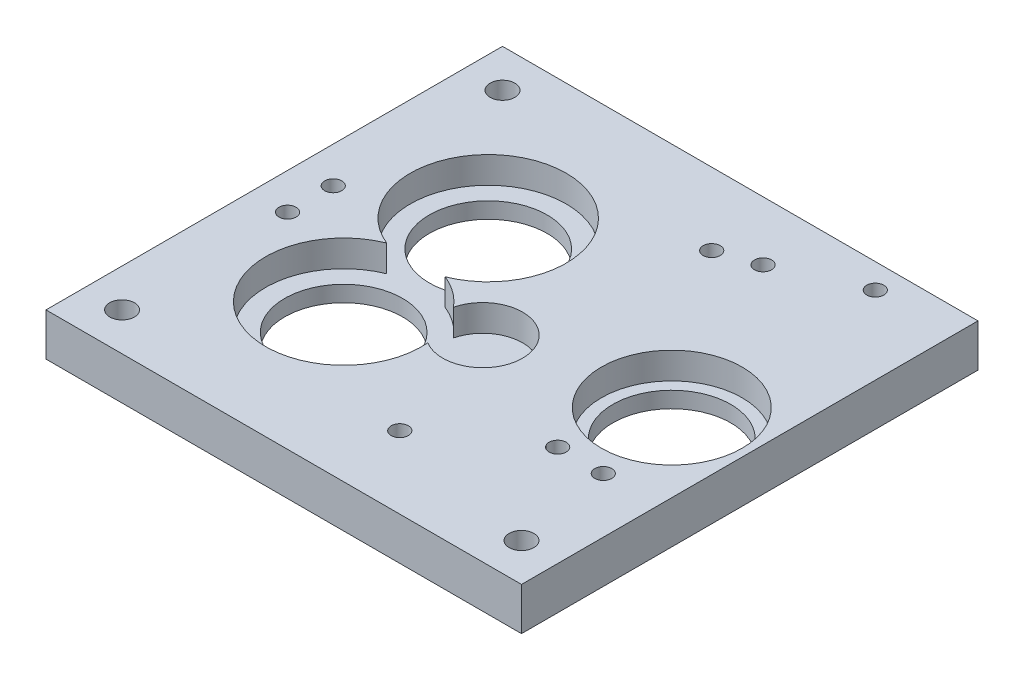
from build123d import *

# Parameters (mm, degrees)
SKETCH1_W                        = 125
SKETCH1_H                        = 120
TEST_BASE_POSTION_DEPTH          = 11.215
SKETCH8_R                        = 20.5
FINGER_GEARS_DEPTH               = 7
SKETCH9_R                        = 10.5
INTERMEDIATE_GEAR_DEPTH          = 7
SKETCH11_R                       = 18.5
XL320_FINGER_KNUCKLE_MOUNT_DEPTH = 7
SKETCH10_R                       = 15.5
CONNECT_FINGER_HOLES_DEPTH       = 88.361468766
THUMB_MOUNT_HOLES_R              = 2.25
THUMB_MOUNT_HOLES_M4_DEPTH       = 88.361468766
SKETCH16_R                       = 2.25
FINGERS_MOUNT_HOLES_M4_DEPTH     = 88.361468766
SKETCH17_R                       = 3.25
CONNECT_HOLES_M6_DEPTH           = 88.361468766
SKETCH18_R                       = 3.75
NUTS_M4_DEPTH                    = 4
SKETCH19_R                       = 5.25
NUTS_M6_DEPTH                    = 6


with BuildPart() as part:
    # Sketch1 → Test_Base_Postion (new body)
    with BuildSketch(Plane(origin=(0, 0, 0), x_dir=(1, 0, 0), z_dir=(0, 1, 0))):
        Rectangle(SKETCH1_W, SKETCH1_H)
    extrude(amount=TEST_BASE_POSTION_DEPTH)

    # Sketch8 → Finger_Gears (cut)
    with BuildSketch(Plane(origin=(0, 11.215, 0), x_dir=(1, 0, 0), z_dir=(0, 1, 0))):
        with Locations((-25.25, -19)):
            Circle(SKETCH8_R)
        with Locations((-25.25, 19)):
            Circle(SKETCH8_R)
    extrude(amount=-FINGER_GEARS_DEPTH, mode=Mode.SUBTRACT)

    # Sketch9 → Intermediate_Gear (cut)
    with BuildSketch(Plane(origin=(0, 11.215, 0), x_dir=(1, 0, 0), z_dir=(0, 1, 0))):
        with Locations((0.646123438, -8.351488795)):
            Circle(SKETCH9_R)
    extrude(amount=-INTERMEDIATE_GEAR_DEPTH, mode=Mode.SUBTRACT)

    # Sketch11 → XL320_Finger_Knuckle_Mount (cut)
    with BuildSketch(Plane(origin=(0, 11.215, 0), x_dir=(1, 0, 0), z_dir=(0, 1, 0))):
        with Locations(Location((42, 0, 0), (0, 0, 270))):
            Circle(SKETCH11_R)
    extrude(amount=-XL320_FINGER_KNUCKLE_MOUNT_DEPTH, mode=Mode.SUBTRACT)

    # Sketch10 → Connect_Finger_Holes (cut, through all)
    with BuildSketch(Plane(origin=(0, 11.215, 0), x_dir=(1, 0, 0), z_dir=(0, 1, 0))):
        with Locations(Location((-25.25, 19, 0), (0, 0, 270))):
            Circle(SKETCH10_R)
        with Locations(Location((-25.25, -19, 0), (0, 0, 270))):
            Circle(SKETCH10_R)
        with Locations(Location((42, 0, 0), (0, 0, 270))):
            Circle(SKETCH10_R)
    extrude(amount=-CONNECT_FINGER_HOLES_DEPTH, mode=Mode.SUBTRACT)

    # Thumb_Mount_Holes → Thumb_Mount_Holes_(M4) (cut, through all)
    with BuildSketch(Plane(origin=(0, 11.215, 0), x_dir=(1, 0, 0), z_dir=(0, 1, 0))):
        with Locations(Location((21.5, 44.5, 0), (0, 0, 270))):
            Circle(THUMB_MOUNT_HOLES_R)
        with Locations(Location((42, 53.5, 0), (0, 0, 270))):
            Circle(THUMB_MOUNT_HOLES_R)
        with Locations(Location((48, -24, 0), (0, 0, 270))):
            Circle(THUMB_MOUNT_HOLES_R)
        with Locations(Location((36, -24, 0), (0, 0, 270))):
            Circle(THUMB_MOUNT_HOLES_R)
    extrude(amount=-THUMB_MOUNT_HOLES_M4_DEPTH, mode=Mode.SUBTRACT)

    # Sketch16 → Fingers_Mount_Holes_(M4) (cut, through all)
    with BuildSketch(Plane(origin=(0, 11.215, 0), x_dir=(1, 0, 0), z_dir=(0, 1, 0))):
        with Locations(Location((11.5, 41, 0), (0, 0, 270))):
            Circle(SKETCH16_R)
        with Locations(Location((11.5, -41, 0), (0, 0, 270))):
            Circle(SKETCH16_R)
        with Locations(Location((-53, 6, 0), (0, 0, 270))):
            Circle(SKETCH16_R)
        with Locations(Location((-53, -6, 0), (0, 0, 270))):
            Circle(SKETCH16_R)
    extrude(amount=-FINGERS_MOUNT_HOLES_M4_DEPTH, mode=Mode.SUBTRACT)

    # Sketch17 → Connect_Holes_(M6) (cut, through all)
    with BuildSketch(Plane(origin=(0, 11.215, 0), x_dir=(1, 0, 0), z_dir=(0, 1, 0))):
        with Locations(Location((-52.5, 50, 0), (0, 0, 270))):
            Circle(SKETCH17_R)
        with Locations(Location((-52.5, -50, 0), (0, 0, 270))):
            Circle(SKETCH17_R)
        with Locations(Location((52.5, -50, 0), (0, 0, 270))):
            Circle(SKETCH17_R)
    extrude(amount=-CONNECT_HOLES_M6_DEPTH, mode=Mode.SUBTRACT)

    # Sketch18 → Nuts_(M4) (cut)
    with BuildSketch(Plane.XZ):
        with Locations(Location((11.5, 41, 0), (0, 0, 270))):
            Circle(SKETCH18_R)
        with Locations(Location((11.5, -41, 0), (0, 0, 270))):
            Circle(SKETCH18_R)
        with Locations(Location((21.5, -44.5, 0), (0, 0, 270))):
            Circle(SKETCH18_R)
        with Locations(Location((42, -53.5, 0), (0, 0, 270))):
            Circle(SKETCH18_R)
    extrude(amount=-NUTS_M4_DEPTH, mode=Mode.SUBTRACT)

    # Sketch19 → Nuts_(M6) (cut)
    with BuildSketch(Plane.XZ):
        with Locations(Location((-52.5, 50, 0), (0, 0, 270))):
            Circle(SKETCH19_R)
        with Locations(Location((52.5, 50, 0), (0, 0, 270))):
            Circle(SKETCH19_R)
        with Locations(Location((-52.5, -50, 0), (0, 0, 270))):
            Circle(SKETCH19_R)
    extrude(amount=-NUTS_M6_DEPTH, mode=Mode.SUBTRACT)


solid = part.part
